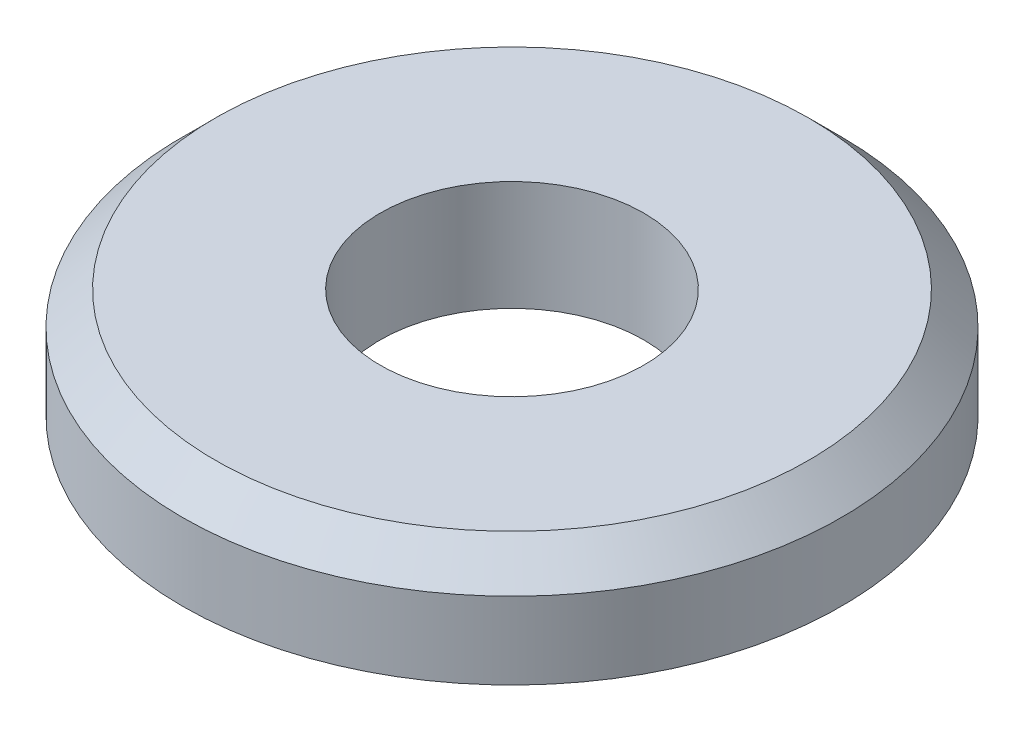
from build123d import *


with BuildPart() as part:
    # Sketch1 → Revolve1 (revolve)
    with BuildSketch(Plane(origin=(0, 0, 0), x_dir=(0, 0, -1), z_dir=(1, 0, 0))):
        Polygon((6, 0), (6, 5), (13.5, 5), (15, 3.5), (15, 0), align=None)
    revolve(axis=Axis((0, 0, 0), (0, 1, 0)))


solid = part.part
